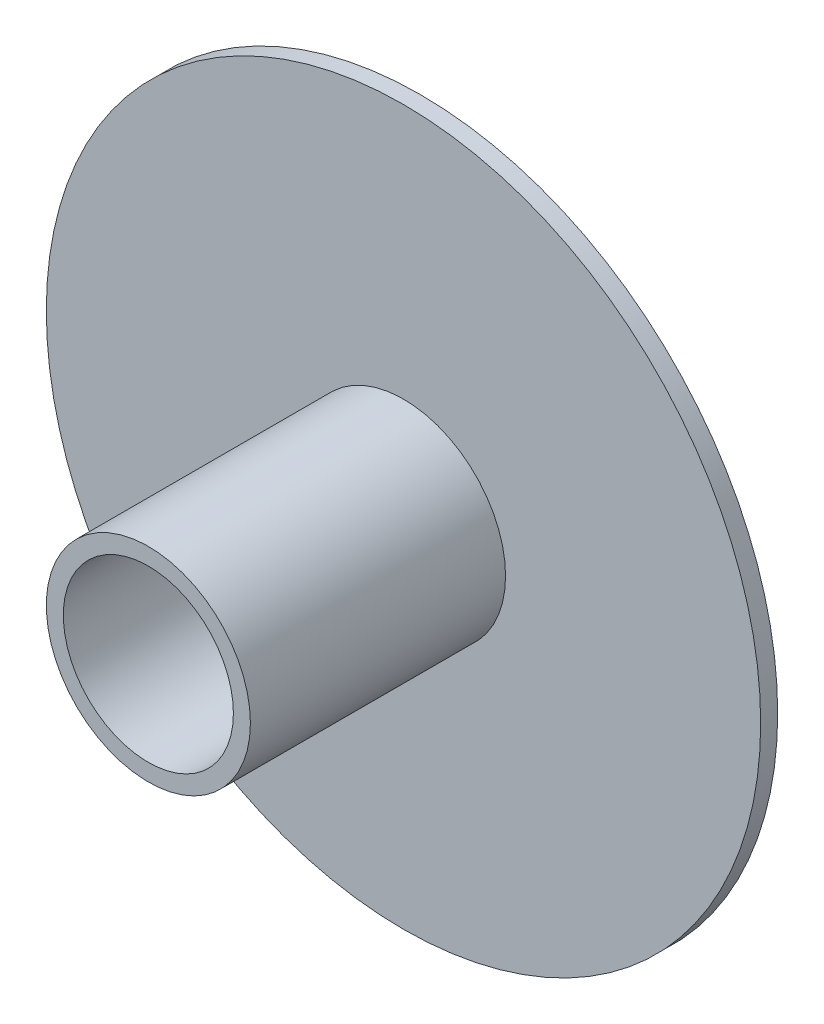
from build123d import *

# Parameters (mm, degrees)
SKETCH1_R               = 21
BOSS_EXTRUDE1_DEPTH     = 1
SKETCH2_R               = 6
BOSS_EXTRUDE2_DEPTH     = 15
CUT_EXTRUDE1_DEPTH      = 34.734255587
CUT_EXTRUDE1_DEPTH_BACK = 34.734255587
SKETCH3_R               = 5


with BuildPart() as part:
    # Sketch1 → Boss-Extrude1 (new body)
    with BuildSketch(Plane.XY):
        Circle(SKETCH1_R)
    extrude(amount=BOSS_EXTRUDE1_DEPTH)

    # Sketch2 → Boss-Extrude2 (add)
    with BuildSketch(Plane.XY.offset(1)):
        Circle(SKETCH2_R)
    extrude(amount=BOSS_EXTRUDE2_DEPTH)

    # Sketch3 → Cut-Extrude1 (cut, two sides: drawn at the far end of the back side and taken through both)
    with BuildSketch(Plane.XY.offset(16).offset(-CUT_EXTRUDE1_DEPTH_BACK)):
        Circle(SKETCH3_R)
    extrude(amount=CUT_EXTRUDE1_DEPTH + CUT_EXTRUDE1_DEPTH_BACK, mode=Mode.SUBTRACT)


solid = part.part
